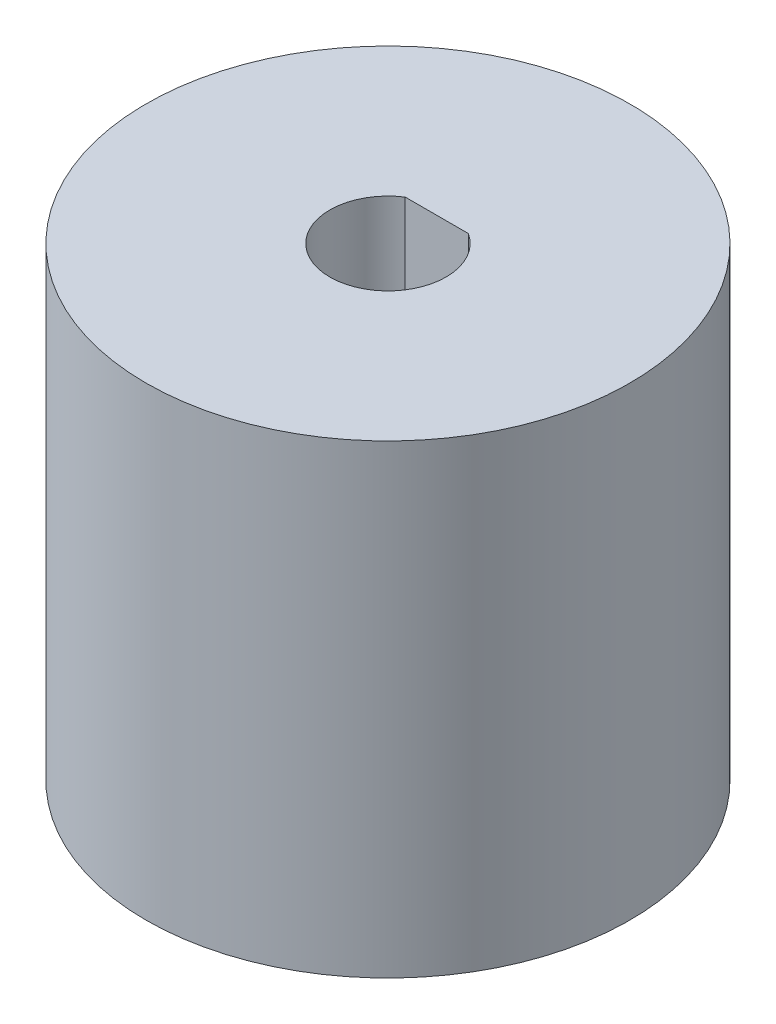
from build123d import *

# Parameters (mm, degrees)
SKETCH1_R           = 13.208
BOSS_EXTRUDE4_DEPTH = 25.4
CUT_EXTRUDE3_DEPTH  = 32.528757159
CUT_EXTRUDE4_DEPTH  = 5.588


with BuildPart() as part:
    # Sketch1 → Boss-Extrude4 (new body)
    with BuildSketch(Plane(origin=(0, 0, 0), x_dir=(1, 0, 0), z_dir=(0, 1, 0))):
        Circle(SKETCH1_R)
    extrude(amount=BOSS_EXTRUDE4_DEPTH)

    # Sketch1<6> → Cut-Extrude3 (cut, through all)
    with BuildSketch(Plane(origin=(0, 0, 0), x_dir=(1, 0, 0), z_dir=(0, 1, 0))):
        with BuildLine():
            Line((1.722711816, 2.667), (0, 2.667))
            Line((0, 2.667), (-1.722711816, 2.667))
            ThreePointArc((-1.722711816, 2.667), (-1.51838977, -2.78838977), (3.175, 0))
            ThreePointArc((3.175, 0), (2.78838977, 1.51838977), (1.722711816, 2.667))
        make_face()
    extrude(amount=CUT_EXTRUDE3_DEPTH, mode=Mode.SUBTRACT)

    # Sketch1<7> → Cut-Extrude4 (cut)
    with BuildSketch(Plane(origin=(0, 0, 0), x_dir=(1, 0, 0), z_dir=(0, 1, 0))):
        with BuildLine():
            Line((-1.722711816, 2.667), (0, 2.667))
            Line((0, 2.667), (1.722711816, 2.667))
            ThreePointArc((1.722711816, 2.667), (0, 3.175), (-1.722711816, 2.667))
        make_face()
    extrude(amount=CUT_EXTRUDE4_DEPTH, mode=Mode.SUBTRACT)


solid = part.part
